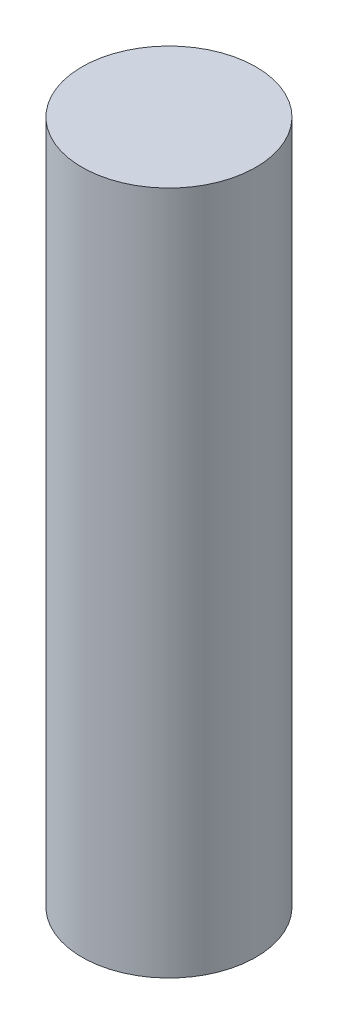
from build123d import *

# Parameters (mm, degrees)
SKETCH1_R           = 14.5
BOSS_EXTRUDE1_DEPTH = 57


with BuildPart() as part:
    # Sketch1 → Boss-Extrude1 (new, symmetric)
    with BuildSketch(Plane(origin=(0, 0, 0), x_dir=(1, 0, 0), z_dir=(0, 1, 0))):
        Circle(SKETCH1_R)
    extrude(amount=BOSS_EXTRUDE1_DEPTH, both=True)


solid = part.part
